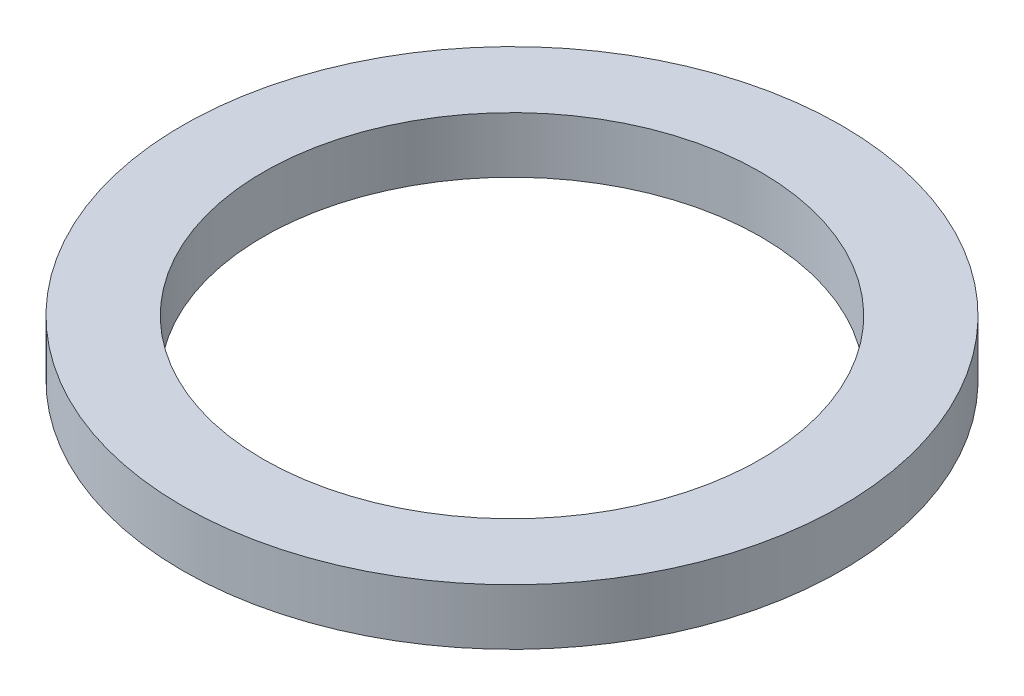
from build123d import *

# Parameters (mm, degrees)
SKETCH1_R           = 5.3
SKETCH1_R_2         = 4
BOSS_EXTRUDE1_DEPTH = 0.45


with BuildPart() as part:
    # Sketch1 → Boss-Extrude1 (new, symmetric)
    with BuildSketch(Plane(origin=(0, 0, 0), x_dir=(1, 0, 0), z_dir=(0, 1, 0))):
        with Locations(Location((0, 0, 0), (0, 0, 270))):
            Circle(SKETCH1_R)
        with Locations(Location((0, 0, 0), (0, 0, 270))):
            Circle(SKETCH1_R_2, mode=Mode.SUBTRACT)
    extrude(amount=BOSS_EXTRUDE1_DEPTH, both=True)


solid = part.part
